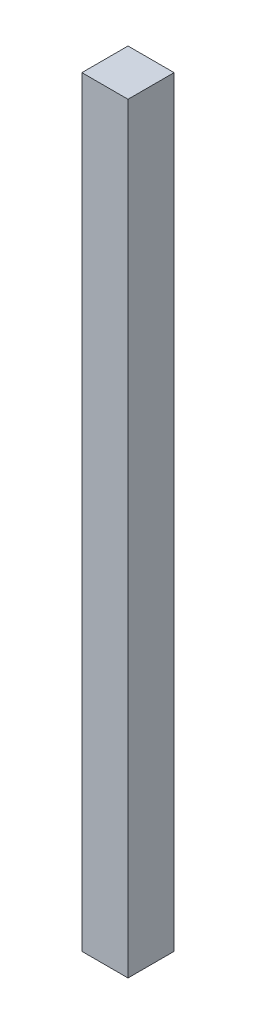
from build123d import *

# Parameters (mm, degrees)
SKETCH1_W           = 20
SKETCH1_H           = 20
BOSS_EXTRUDE1_DEPTH = 330.046357855


with BuildPart() as part:
    # Sketch1 → Boss-Extrude1 (new body)
    with BuildSketch(Plane(origin=(0, 0, 0), x_dir=(1, 0, 0), z_dir=(0, 1, 0))):
        with Locations((10, -10)):
            Rectangle(SKETCH1_W, SKETCH1_H)
    extrude(amount=BOSS_EXTRUDE1_DEPTH)


solid = part.part
